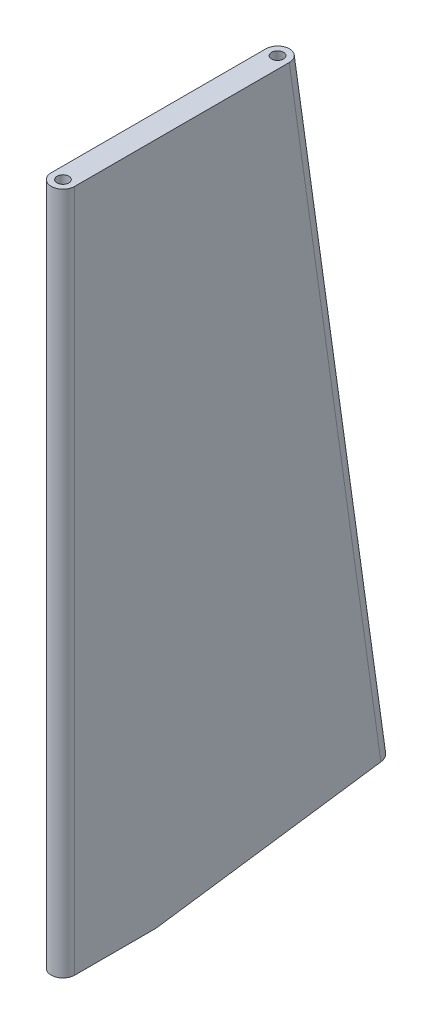
from build123d import *

# Parameters (mm, degrees)
EXTRUDE_1_DEPTH = 2
SKETCH_2_R      = 0.5
EXTRUDE_2_DEPTH = 58
EXTRUDE_3_REACH = 65.509
SKETCH_3_R      = 0.5


with BuildPart() as part:
    # Эскиз1 → Бобышка-Вытянуть1 (new body)
    with BuildSketch(Plane(origin=(0, 0, 0), x_dir=(0, 0, -1), z_dir=(1, 0, 0))):
        Polygon((0, 58), (16.206306346, 58), (24, 2.54498815), (5.89146837, 0), (0, 0), align=None)
    extrude(amount=EXTRUDE_1_DEPTH)

    # Эскиз2 → Бобышка-Вытянуть2 (add)
    with BuildSketch(Plane(origin=(0, 0, 0), x_dir=(1, 0, 0), z_dir=(0, 1, 0))):
        with BuildLine():
            Line((2, 0), (0, 0))
            Line((0, 0), (0, -1))
            ThreePointArc((0, -1), (1, -2), (2, -1))
            Line((2, -1), (2, 0))
        make_face()
        with Locations(Location((1, -1, 0), (0, 0, 270))):
            Circle(SKETCH_2_R, mode=Mode.SUBTRACT)
    extrude(amount=EXTRUDE_2_DEPTH)

    # Бобышка-Вытянуть3: up to this plane
    extrude_3_end = Plane(origin=(2, 58, 0), z_dir=(0, 1, 0))
    # Эскиз3 → Бобышка-Вытянуть3 (add, up to the surface)
    with BuildSketch(Plane(origin=(0, -0.811954382, -0.114112747), x_dir=(1, 0, 0), z_dir=(0, -0.9902680687415703, -0.13917310096006588)), mode=Mode.PRIVATE) as extrude_3_sk1:
        with BuildLine():
            Line((0, -25.120627543), (0, -24.120627543))
            Line((0, -24.120627543), (2, -24.120627543))
            Line((2, -24.120627543), (2, -25.120627543))
            ThreePointArc((2, -25.120627543), (1, -26.120627543), (0, -25.120627543))
        make_face()
        with Locations(Location((1, -25.120627543, 0), (0, 0, 270))):
            Circle(SKETCH_3_R, mode=Mode.SUBTRACT)
    extrude_3_tool1 = split(extrude(extrude_3_sk1.sketch, amount=-EXTRUDE_3_REACH, mode=Mode.PRIVATE), bisect_by=extrude_3_end, keep=Keep.BOTH, mode=Mode.PRIVATE)
    add(extrude_3_tool1.solids().sort_by_distance((1, 2.819398, -25.952527))[0])


solid = part.part
